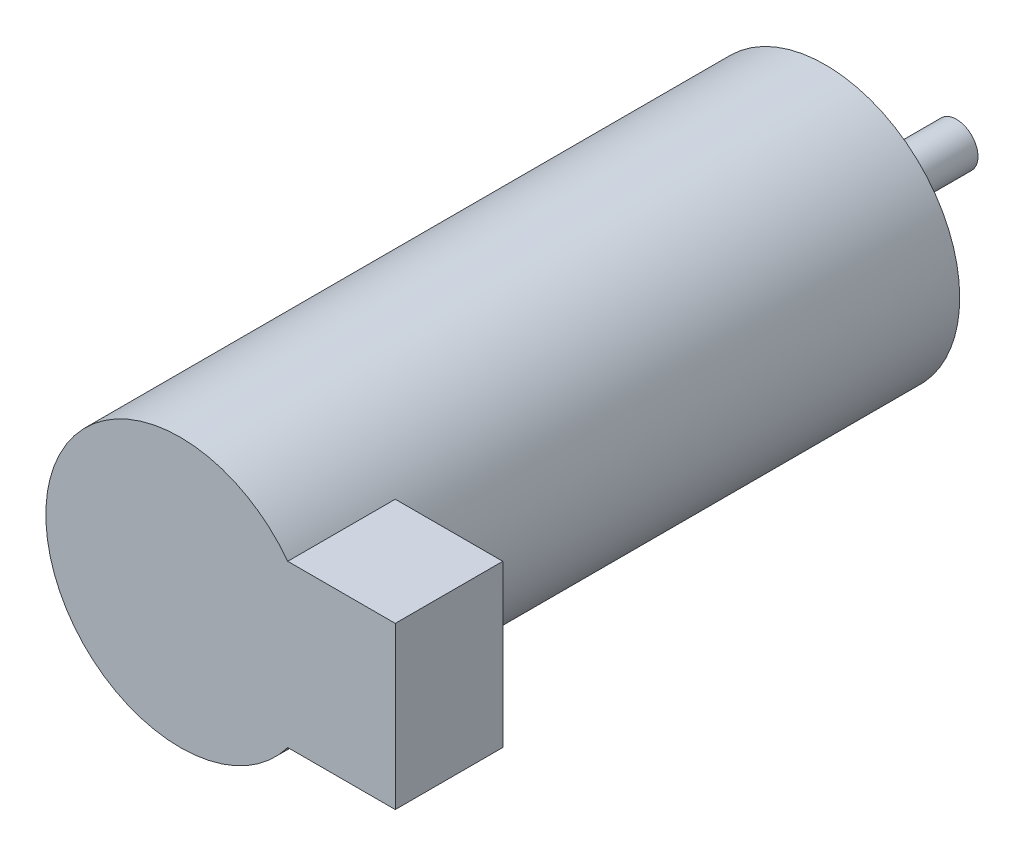
from build123d import *

# Parameters (mm, degrees)
SKETCH1_R           = 12.5
BOSS_EXTRUDE1_DEPTH = 60
SKETCH2_R           = 1.5
CUT_EXTRUDE1_DEPTH  = 3.5
SKETCH2_3_R         = 3.5
SKETCH2_3_R_2       = 2
BOSS_EXTRUDE2_DEPTH = 2.5
SKETCH2_4_R         = 2
BOSS_EXTRUDE3_DEPTH = 12.2
SKETCH3_W           = 10
SKETCH3_H           = 15
BOSS_EXTRUDE4_DEPTH = 20


with BuildPart() as part:
    # Sketch1 → Boss-Extrude1 (new body)
    with BuildSketch(Plane.XY):
        Circle(SKETCH1_R)
    extrude(amount=BOSS_EXTRUDE1_DEPTH)

    # Sketch2 → Cut-Extrude1 (cut)
    with BuildSketch(Plane.XY):
        with Locations((8.5, 0)):
            Circle(SKETCH2_R)
        with Locations((-8.5, 0)):
            Circle(SKETCH2_R)
    extrude(amount=CUT_EXTRUDE1_DEPTH, mode=Mode.SUBTRACT)

    # Sketch2<3> → Boss-Extrude2 (add)
    with BuildSketch(Plane.XY):
        Circle(SKETCH2_3_R)
        Circle(SKETCH2_3_R_2, mode=Mode.SUBTRACT)
    extrude(amount=-BOSS_EXTRUDE2_DEPTH)

    # Sketch2<4> → Boss-Extrude3 (add)
    with BuildSketch(Plane.XY):
        Circle(SKETCH2_4_R)
    extrude(amount=-BOSS_EXTRUDE3_DEPTH)

    # Sketch3 → Boss-Extrude4 (add)
    with BuildSketch(Plane(origin=(0, 0, 0), x_dir=(0, 0, -1), z_dir=(1, 0, 0))):
        with Locations((-55, 0)):
            Rectangle(SKETCH3_W, SKETCH3_H)
    extrude(amount=BOSS_EXTRUDE4_DEPTH)


solid = part.part
